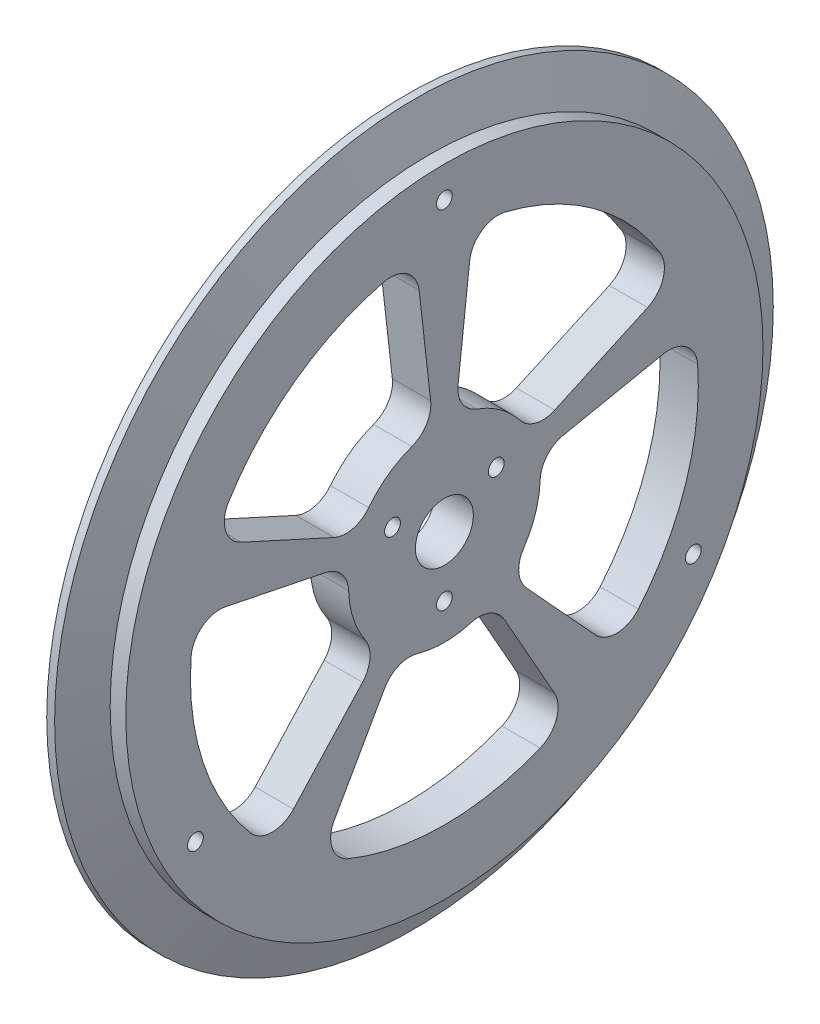
from build123d import *

# Parameters (mm, degrees)
SKETCH5_R                = 6.05
CUT_EXTRUDE1_DEPTH       = 107.367288205
SKETCH7_R                = 1.65
CUT_EXTRUDE3_DEPTH       = 107.367288205
CUT_EXTRUDE4_DEPTH       = 107.367288205
FILLET1_R                = 6
CIRPATTERN1_COUNT        = 5
FILLET1_OF_CIRPATTERN1_R = 6


with BuildPart() as part:
    # Sketch3 → Revolve1 (revolve)
    with BuildSketch(Plane.XY):
        Polygon((0, 0), (8, 0), (8, 66.5), (4.743746991, 66.5), (1.65, 75), (0, 75), align=None)
    revolve(axis=Axis((0, 0, 0), (1, 0, 0)))

    # Sketch5 → Cut-Extrude1 (cut, through all)
    with BuildSketch(Plane(origin=(0, 0, 0), x_dir=(0, 0, -1), z_dir=(1, 0, 0))):
        Circle(SKETCH5_R)
    extrude(amount=CUT_EXTRUDE1_DEPTH, mode=Mode.SUBTRACT)

    # Sketch7 → Cut-Extrude3 (cut, through all)
    with BuildSketch(Plane(origin=(8, 0, 0), x_dir=(0, 0, -1), z_dir=(1, 0, 0))):
        with Locations((0, 60)):
            Circle(SKETCH7_R)
        with Locations((51.961524227, -30)):
            Circle(SKETCH7_R)
        with Locations((-51.961524227, -30)):
            Circle(SKETCH7_R)
        with Locations((10.825317547, 6.25)):
            Circle(SKETCH7_R)
        with Locations((0, -12.5)):
            Circle(SKETCH7_R)
        with Locations((-10.825317547, 6.25)):
            Circle(SKETCH7_R)
    extrude(amount=-CUT_EXTRUDE3_DEPTH, mode=Mode.SUBTRACT)

    # Sketch8 → Cut-Extrude4 (cut, through all)
    with BuildSketch(Plane(origin=(8, 0, 0), x_dir=(0, 0, -1), z_dir=(1, 0, 0))):
        with BuildLine():
            Line((2.264064275, 19.871437114), (5.99977033, 52.659308351))
            ThreePointArc((5.99977033, 52.659308351), (31.152618372, 42.877900702), (48.227947356, 21.978741861))
            Line((48.227947356, 21.978741861), (18.199225418, 8.293864853))
            ThreePointArc((18.199225418, 8.293864853), (11.755705046, 16.180339887), (2.264064275, 19.871437114))
        make_face()
    cut_extrude4 = extrude(amount=-CUT_EXTRUDE4_DEPTH, mode=Mode.SUBTRACT)

    # Fillet1
    fillet1_edges = [part.edges().sort_by_distance(p)[0] for p in [
        (4, 21.978741861, -48.227947356),
        (4, 52.659308351, -5.99977033),
        (4, 8.293864853, -18.199225418),
        (4, 19.871437114, -2.264064275),
    ]]
    fillet(fillet1_edges, radius=FILLET1_R)

    # CirPattern1: Cut-Extrude4 ×5 about axis
    cirpattern1_axis = Axis((8, 0, 0), (-1, 0, 0))
    for i in range(1, CIRPATTERN1_COUNT):
        add(cut_extrude4.rotate(cirpattern1_axis, i * 360 / CIRPATTERN1_COUNT), mode=Mode.SUBTRACT)

    # Fillet1 of CirPattern1
    fillet1_of_cirpattern1_edges = [part.edges().sort_by_distance(p)[0] for p in [
        (4, -39.075698851, -35.806281004),
        (4, 10.566500524, -51.936009345),
        (4, -14.745546736, -13.511804152),
        (4, 3.987358688, -19.598494092),
        (4, -46.128851885, 26.098448685),
        (4, -46.128851885, -26.098448685),
        (4, -17.407113919, 9.848471202),
        (4, -17.407113919, -9.848471202),
        (4, 10.566500524, 51.936009345),
        (4, -39.075698851, 35.806281004),
        (4, 3.987358688, 19.598494092),
        (4, -14.745546736, 13.511804152),
        (4, 52.659308351, 5.99977033),
        (4, 21.978741861, 48.227947356),
        (4, 19.871437114, 2.264064275),
        (4, 8.293864853, 18.199225418),
    ]]
    fillet(fillet1_of_cirpattern1_edges, radius=FILLET1_OF_CIRPATTERN1_R)


solid = part.part
